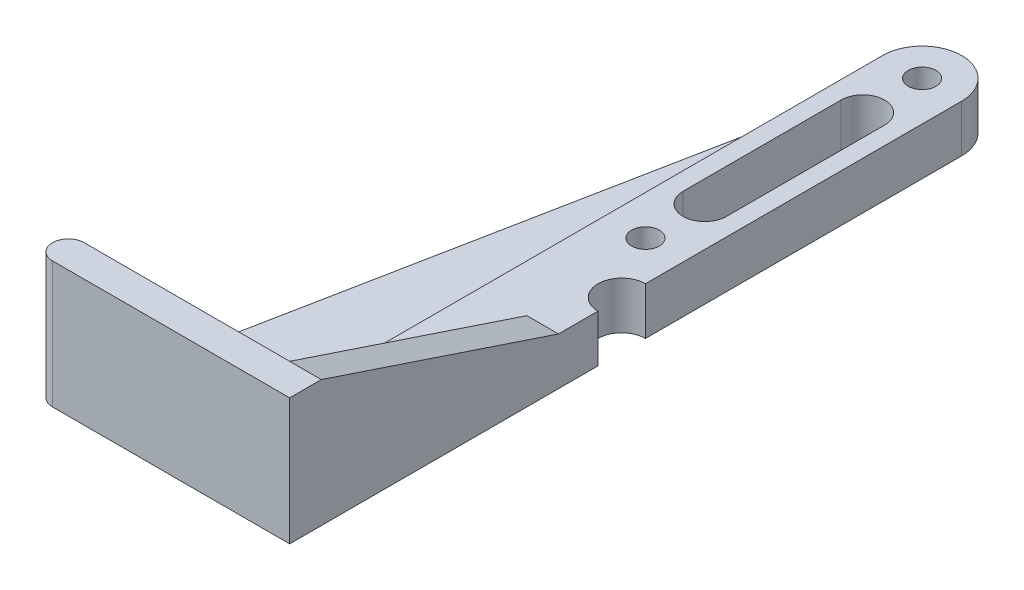
from build123d import *

# Parameters (mm, degrees)
BOSS_EXTRUDE1_DEPTH             = 6
BOSS_EXTRUDE2_DEPTH             = 10
BOSS_EXTRUDE2_DIRECTION_2_REACH = 87.358
RIB1_REACH                      = 92.609
SKETCH3_WALL_W                  = 266.260300784
SKETCH3_WALL_H                  = 3
CUT_EXTRUDE1_REACH              = 91.744
SKETCH4_R                       = 1.75
BOSS_EXTRUDE3_DEPTH             = 4
CUT_EXTRUDE2_REACH              = 91.744


with BuildPart() as part:
    # Sketch1 → Boss-Extrude1 (new body)
    with BuildSketch(Plane(origin=(0, 0, 0), x_dir=(1, 0, 0), z_dir=(0, 1, 0))):
        with BuildLine():
            Line((5, 0), (5, -85))
            Line((5, -85), (-5, -85))
            Line((-5, -85), (-5, 0))
            ThreePointArc((-5, 0), (0, 5), (5, 0))
        make_face()
    extrude(amount=BOSS_EXTRUDE1_DEPTH)

    # Sketch2 → Boss-Extrude2 (add)
    with BuildSketch(Plane(origin=(0, 6, 0), x_dir=(1, 0, 0), z_dir=(0, 1, 0))):
        with BuildLine():
            Line((5, -81), (5, -85))
            Line((5, -85), (-25, -85))
            ThreePointArc((-25, -85), (-27, -83), (-25, -81))
            Line((-25, -81), (5, -81))
        make_face()
    extrude(amount=BOSS_EXTRUDE2_DEPTH)

    # Boss-Extrude2 direction 2: up to this face of the body (flat: up to its plane)
    boss_extrude2_direction_2_end = Plane(part.part.faces().sort_by_distance((0, 0, 40.529502163))[0])
    # Sketch2 → Boss-Extrude2 direction 2 (add, up to the picked face)
    with BuildSketch(Plane(origin=(0, 6, 0), x_dir=(1, 0, 0), z_dir=(0, 1, 0)), mode=Mode.PRIVATE) as boss_extrude2_direction_2_sk1:
        with BuildLine():
            Line((5, -81), (5, -85))
            Line((5, -85), (-25, -85))
            ThreePointArc((-25, -85), (-27, -83), (-25, -81))
            Line((-25, -81), (5, -81))
        make_face()
    boss_extrude2_direction_2_tool1 = split(extrude(boss_extrude2_direction_2_sk1.sketch, amount=-BOSS_EXTRUDE2_DIRECTION_2_REACH, mode=Mode.PRIVATE), bisect_by=boss_extrude2_direction_2_end, keep=Keep.BOTH, mode=Mode.PRIVATE)
    add(boss_extrude2_direction_2_tool1.solids().sort_by(Axis((-10.788554, 6, 83), (0, -1, 0)))[0])

    # Sketch3 wall → Rib1 (add, up to next)
    with BuildSketch(Plane(origin=(-13, 0, 40.256880935), x_dir=(-0.192673122493, 0, 0.98126299628), z_dir=(0.98126299628, 0, 0.192673122493)), mode=Mode.PRIVATE) as rib1_sk1:
        with Locations((0, -1.5)):
            Rectangle(SKETCH3_WALL_W, SKETCH3_WALL_H)
    rib1_tool1 = extrude(rib1_sk1.sketch, amount=RIB1_REACH, mode=Mode.PRIVATE) - part.part
    add(rib1_tool1.solids().sort_by_distance((-13, 0, 40.256880935))[0])

    # Sketch4 → Cut-Extrude1 (cut, up to next)
    with BuildSketch(Plane(origin=(0, 6, 0), x_dir=(1, 0, 0), z_dir=(0, 1, 0)), mode=Mode.PRIVATE) as cut_extrude1_sk1:
        with Locations(Location((0, 0, 0), (0, 0, 270))):
            Circle(SKETCH4_R)
    cut_extrude1_tool1 = extrude(cut_extrude1_sk1.sketch, amount=-CUT_EXTRUDE1_REACH, mode=Mode.PRIVATE) & part.part
    # Sketch4 → Cut-Extrude1 (cut, up to next)
    with BuildSketch(Plane(origin=(0, 6, 0), x_dir=(1, 0, 0), z_dir=(0, 1, 0)), mode=Mode.PRIVATE) as cut_extrude1_sk2:
        with Locations(Location((0, -35, 0), (0, 0, 270))):
            Circle(SKETCH4_R)
    cut_extrude1_tool2 = extrude(cut_extrude1_sk2.sketch, amount=-CUT_EXTRUDE1_REACH, mode=Mode.PRIVATE) & part.part
    # Sketch4 → Cut-Extrude1 (cut, up to next)
    with BuildSketch(Plane(origin=(0, 6, 0), x_dir=(1, 0, 0), z_dir=(0, 1, 0)), mode=Mode.PRIVATE) as cut_extrude1_sk3:
        with BuildLine():
            Line((2.75, -7.5), (2.75, -27.5))
            ThreePointArc((2.75, -27.5), (0, -30.25), (-2.75, -27.5))
            Line((-2.75, -27.5), (-2.75, -7.5))
            ThreePointArc((-2.75, -7.5), (0, -4.75), (2.75, -7.5))
        make_face()
    cut_extrude1_tool3 = extrude(cut_extrude1_sk3.sketch, amount=-CUT_EXTRUDE1_REACH, mode=Mode.PRIVATE) & part.part
    add(cut_extrude1_tool1.solids().sort_by_distance((0, 6, 0))[0], mode=Mode.SUBTRACT)
    add(cut_extrude1_tool2.solids().sort_by_distance((0, 6, 35))[0], mode=Mode.SUBTRACT)
    add(cut_extrude1_tool3.solids().sort_by_distance((0, 6, 17.5))[0], mode=Mode.SUBTRACT)

    # Sketch5 → Boss-Extrude3 (add)
    with BuildSketch(Plane(origin=(5, 0, 0), x_dir=(0, 0, -1), z_dir=(1, 0, 0))):
        Polygon((-81, 16), (-51, 6), (-81, 6), align=None)
    extrude(amount=-BOSS_EXTRUDE3_DEPTH)

    # Sketch6 → Cut-Extrude2 (cut, up to next)
    with BuildSketch(Plane(origin=(0, 6, 0), x_dir=(1, 0, 0), z_dir=(0, 1, 0)), mode=Mode.PRIVATE) as cut_extrude2_sk1:
        with BuildLine():
            Line((5, -40), (5, -46))
            ThreePointArc((5, -46), (2, -43), (5, -40))
        make_face()
    cut_extrude2_tool1 = extrude(cut_extrude2_sk1.sketch, amount=-CUT_EXTRUDE2_REACH, mode=Mode.PRIVATE) & part.part
    add(cut_extrude2_tool1.solids().sort_by_distance((3.72676, 6, 43))[0], mode=Mode.SUBTRACT)


solid = part.part
